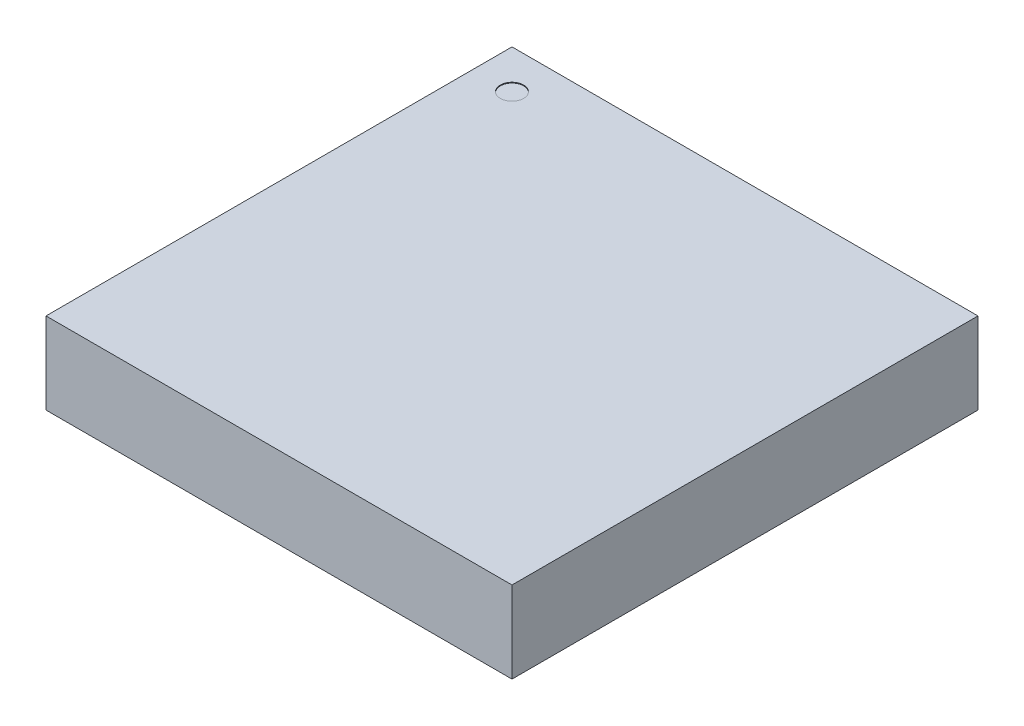
from build123d import *

# Parameters (mm, degrees)
SKETCH1_W           = 6
SKETCH1_H           = 6
BOSS_EXTRUDE1_DEPTH = 1.05
SKETCH2_R           = 0.15
CUT_EXTRUDE1_DEPTH  = 0.01


with BuildPart() as part:
    # Sketch1 → Boss-Extrude1 (new body)
    with BuildSketch(Plane(origin=(0, 0, 0), x_dir=(1, 0, 0), z_dir=(0, 1, 0))):
        with Locations((0.716477935, -0.100467197)):
            Rectangle(SKETCH1_W, SKETCH1_H)
    extrude(amount=BOSS_EXTRUDE1_DEPTH)

    # Sketch2 → Cut-Extrude1 (cut)
    with BuildSketch(Plane(origin=(0, 1.05, 0), x_dir=(1, 0, 0), z_dir=(0, 1, 0))):
        with Locations(Location((-1.783522065, 2.399532803, 0), (0, 0, 270))):
            Circle(SKETCH2_R)
    extrude(amount=-CUT_EXTRUDE1_DEPTH, mode=Mode.SUBTRACT)


solid = part.part
